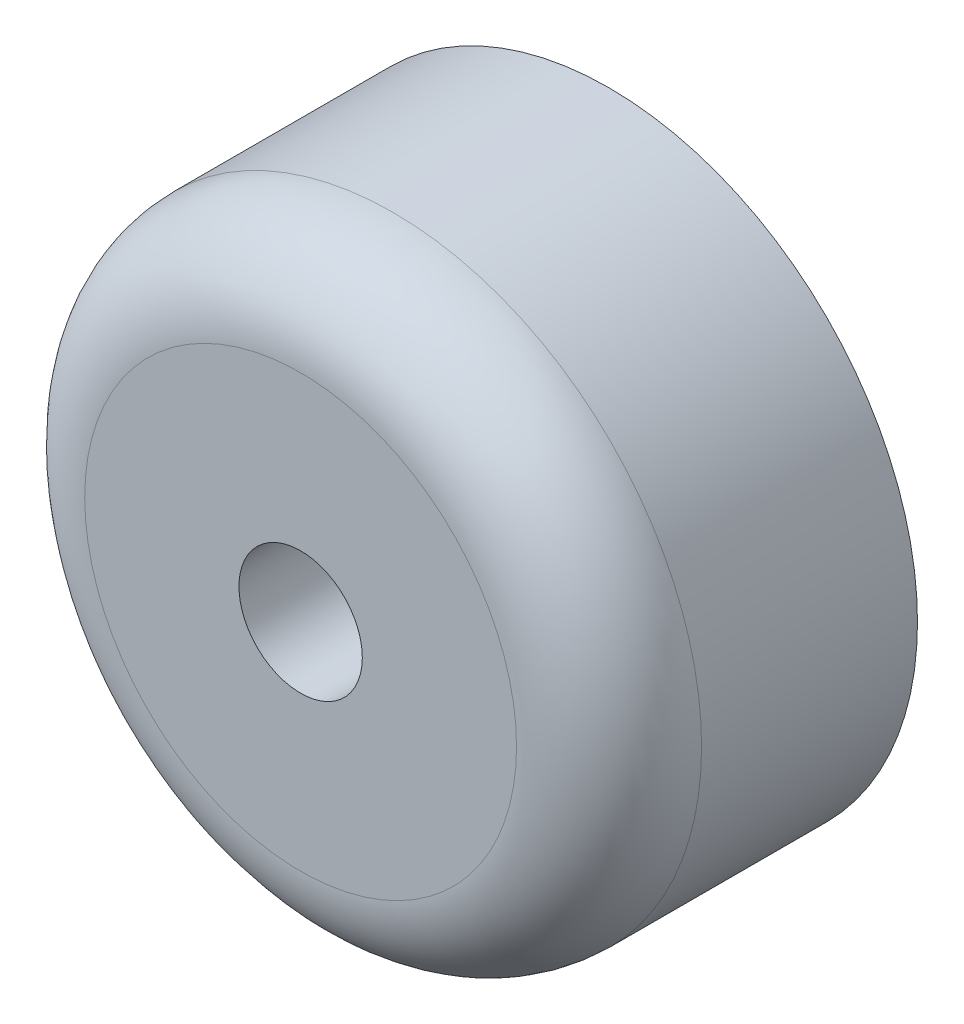
from build123d import *

# Parameters (mm, degrees)
SKETCH1_R           = 10
BOSS_EXTRUDE1_DEPTH = 10
FILLET1_R           = 3
SKETCH2_R           = 2
CUT_EXTRUDE1_DEPTH  = 7


with BuildPart() as part:
    # Sketch1 → Boss-Extrude1 (new body)
    with BuildSketch(Plane.XY):
        with Locations((0, -3.665819089)):
            Circle(SKETCH1_R)
    extrude(amount=BOSS_EXTRUDE1_DEPTH)

    # Fillet1
    fillet1_edges = [part.edges().sort_by_distance(p)[0] for p in [
        (-10, -3.665819089, 10),
    ]]
    fillet(fillet1_edges, radius=FILLET1_R)

    # Sketch2 → Cut-Extrude1 (cut)
    with BuildSketch(Plane.XY.offset(10)):
        with Locations((0, -3.665819089)):
            Circle(SKETCH2_R)
    extrude(amount=-CUT_EXTRUDE1_DEPTH, mode=Mode.SUBTRACT)


solid = part.part
